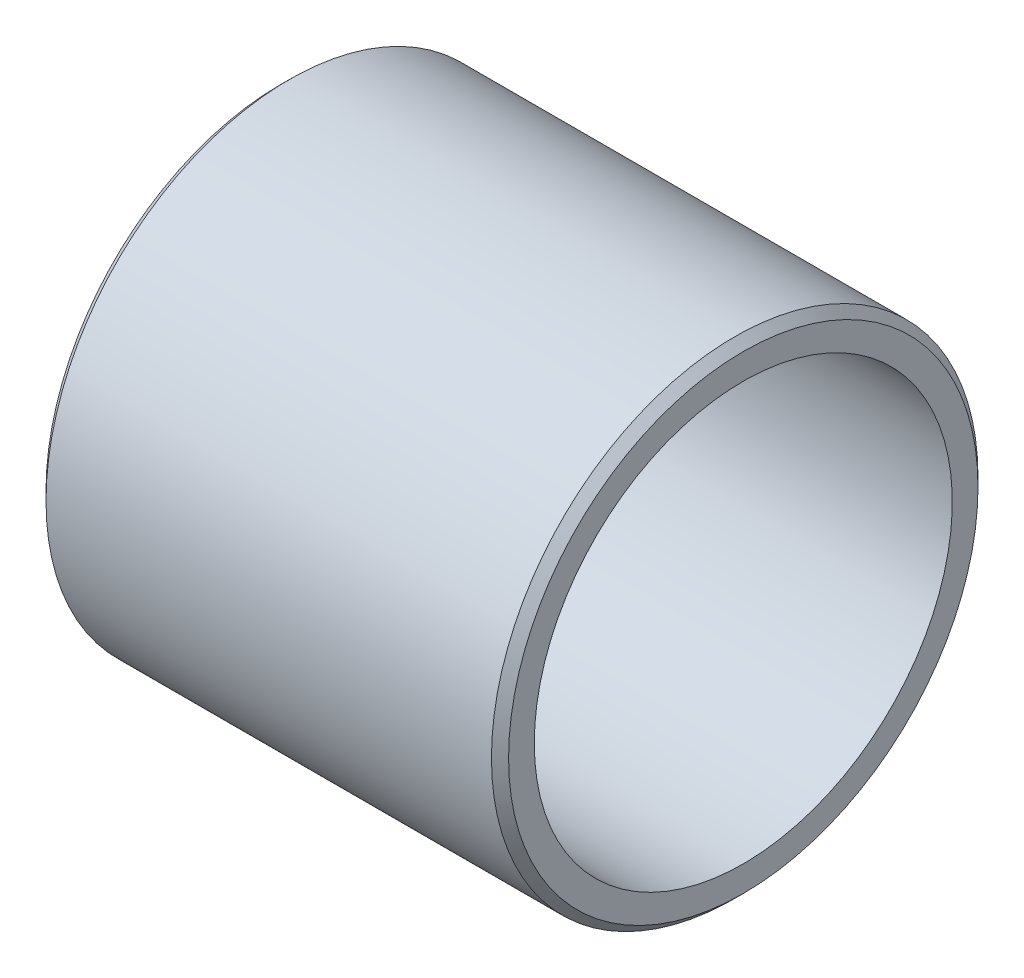
from build123d import *

# Parameters (mm, degrees)
ESQUISSE1_W     = 27
ESQUISSE1_H     = 2
CHANFREIN1_SIZE = 0.5


with BuildPart() as part:
    # Esquisse1 → Base-Révol.-Mince (revolve)
    with BuildSketch(Plane.XY, mode=Mode.PRIVATE) as base_r_vol_mince_sk:
        with Locations((0, 13.2)):
            Rectangle(ESQUISSE1_W, ESQUISSE1_H)
    revolve(base_r_vol_mince_sk.sketch.rotate(Axis((0, 0, 0), (1, 0, 0)), 90), axis=Axis((0, 0, 0), (1, 0, 0)))

    # Chanfrein1
    chanfrein1_edges = [part.edges().sort_by_distance(p)[0] for p in [
        (-13.5, 0, -14.2),
        (13.5, 0, -14.2),
    ]]
    chamfer(chanfrein1_edges, length=CHANFREIN1_SIZE)


solid = part.part
